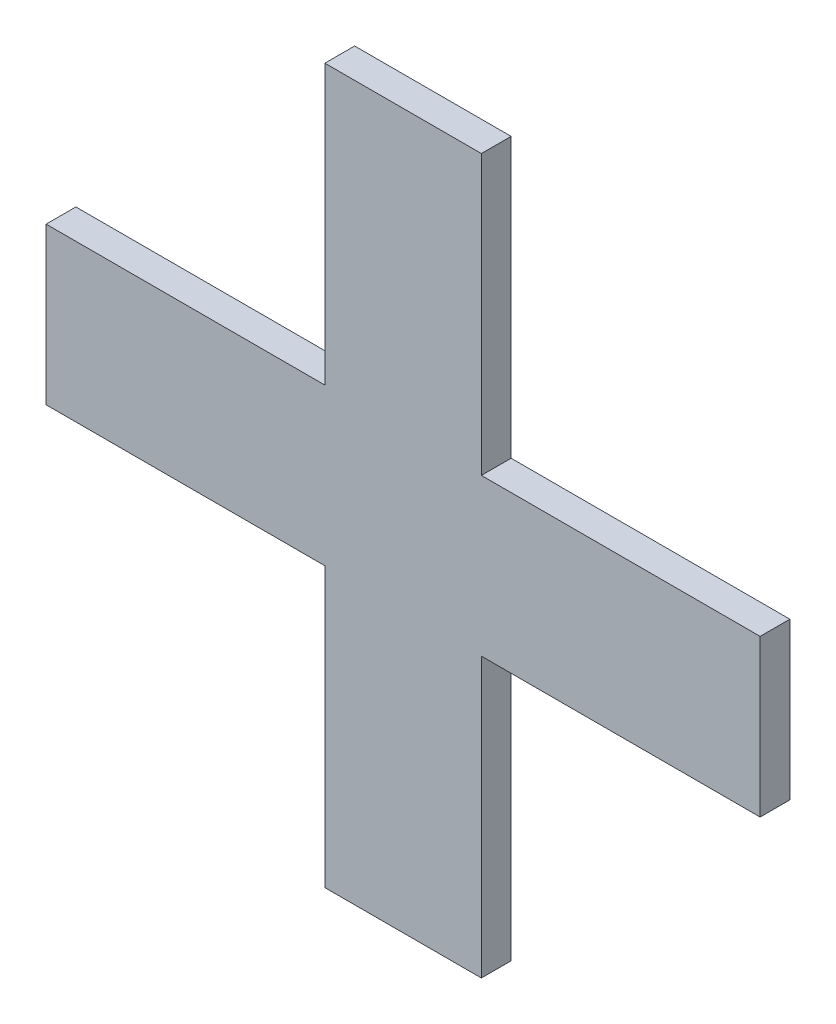
from build123d import *

# Parameters (mm, degrees)
SKETCH1_W           = 46.85
SKETCH1_H           = 26.3
SKETCH1_W_2         = 26.3
SKETCH1_H_2         = 46.85
BOSS_EXTRUDE1_DEPTH = 5


with BuildPart() as part:
    # Sketch1 → Boss-Extrude1 (new body)
    with BuildSketch(Plane.XY):
        with Locations((-36.575, 0)):
            Rectangle(SKETCH1_W, SKETCH1_H)
        Rectangle(SKETCH1_W_2, SKETCH1_H)
        with Locations((36.575, 0)):
            Rectangle(SKETCH1_W, SKETCH1_H)
        with Locations((0, -36.575)):
            Rectangle(SKETCH1_W_2, SKETCH1_H_2)
        with Locations((0, 36.575)):
            Rectangle(SKETCH1_W_2, SKETCH1_H_2)
    extrude(amount=BOSS_EXTRUDE1_DEPTH)


solid = part.part
